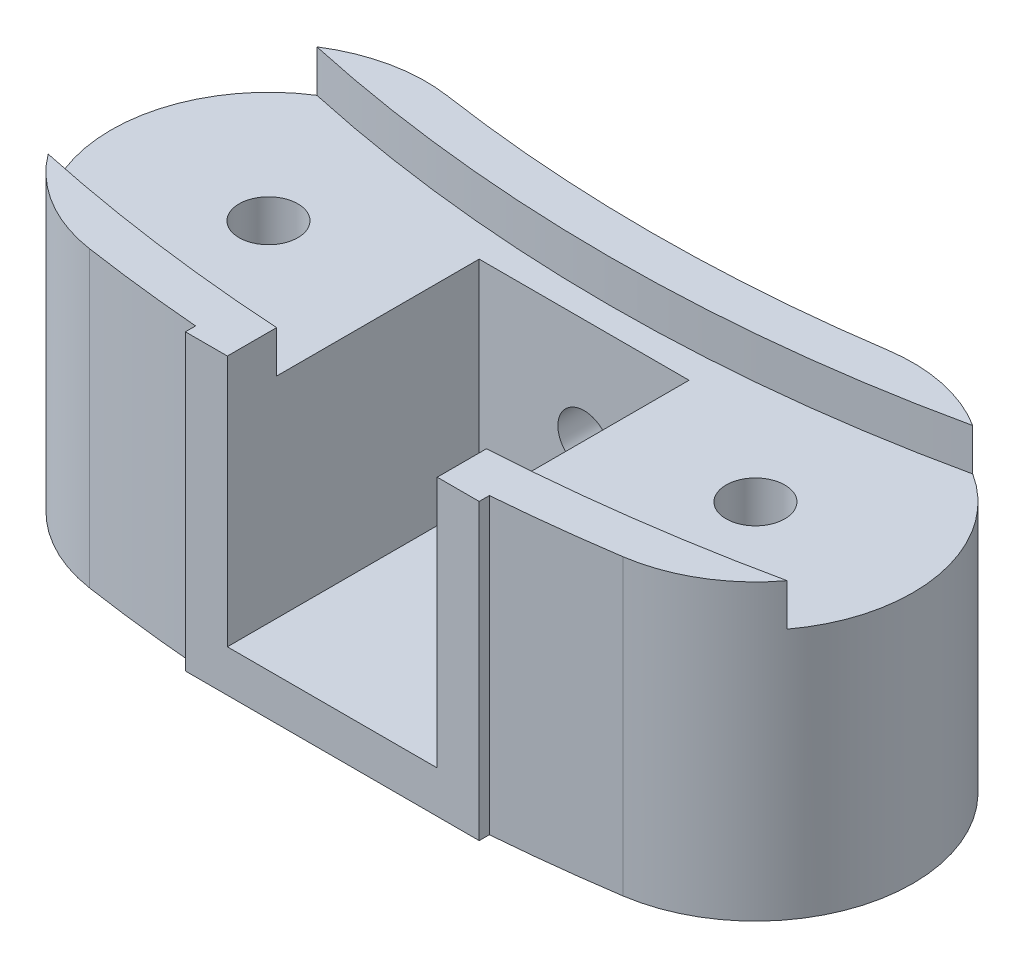
from build123d import *

# Parameters (mm, degrees)
SKETCH2_R                = 1.4
BOSS_EXTRUDE1_DEPTH      = 12
BOSS_EXTRUDE5_DEPTH      = 2
BOSS_EXTRUDE2_REACH      = 30.617
BOSS_EXTRUDE2_END_RADIUS = 86
SKETCH3_W                = 14
SKETCH3_H                = 14
SKETCH15_W               = 10
SKETCH15_H               = 10
SKETCH15_H_2             = 2
CUT_EXTRUDE1_DEPTH       = 12
SKETCH16_R               = 1.25
CUT_EXTRUDE2_DEPTH       = 27.55044426


with BuildPart() as part:
    # Sketch2 → Boss-Extrude1 (new body)
    with BuildSketch(Plane(origin=(0, 0, 0), x_dir=(1, 0, 0), z_dir=(0, 1, 0))):
        with BuildLine():
            ThreePointArc((10.49446819, 8.279873701), (0, 7.5), (-10.49446819, 8.279873701))
            ThreePointArc((-10.49446819, 8.279873701), (-19.020657749, 1.97082531), (-12.711609357, -6.555364249))
            ThreePointArc((-12.711609357, -6.555364249), (0, -7.5), (12.711609357, -6.555364249))
            ThreePointArc((12.711609357, -6.555364249), (19.020657749, 1.97082531), (10.49446819, 8.279873701))
        make_face()
        with Locations(Location((-11.603038774, 0.862254726, 0), (0, 0, 270))):
            Circle(SKETCH2_R, mode=Mode.SUBTRACT)
        with Locations(Location((11.603038774, 0.862254726, 0), (0, 0, 270))):
            Circle(SKETCH2_R, mode=Mode.SUBTRACT)
    extrude(amount=BOSS_EXTRUDE1_DEPTH)

    # Sketch14 → Boss-Extrude5 (add)
    with BuildSketch(Plane(origin=(0, 12, 0), x_dir=(1, 0, 0), z_dir=(0, 1, 0))):
        with BuildLine():
            ThreePointArc((-10.49446819, 8.279873701), (-13.158435282, 8.199198347), (-15.625987479, 7.192016469))
            ThreePointArc((-15.625987479, 7.192016469), (0, 5.5), (15.625987479, 7.192016469))
            ThreePointArc((15.625987479, 7.192016469), (13.158435282, 8.199198347), (10.49446819, 8.279873701))
            ThreePointArc((10.49446819, 8.279873701), (0, 7.5), (-10.49446819, 8.279873701))
        make_face()
        with BuildLine():
            ThreePointArc((17.605627343, -3.634291778), (0, -5.5), (-17.605627343, -3.634291778))
            ThreePointArc((-17.605627343, -3.634291778), (-15.446905606, -5.577829728), (-12.711609357, -6.555364249))
            ThreePointArc((-12.711609357, -6.555364249), (0, -7.5), (12.711609357, -6.555364249))
            ThreePointArc((12.711609357, -6.555364249), (15.446905606, -5.577829728), (17.605627343, -3.634291778))
        make_face()
    extrude(amount=BOSS_EXTRUDE5_DEPTH)

    # Boss-Extrude2: up to this cylinder (the profile starts outside it)
    boss_extrude2_end = Plane(origin=(0, 7, -78.5), z_dir=(0, -1, 0)) * Cylinder(BOSS_EXTRUDE2_END_RADIUS, 234.234, mode=Mode.PRIVATE)
    # Sketch3 → Boss-Extrude2 (add, up to the surface)
    with BuildSketch(Plane.XY.offset(7.7), mode=Mode.PRIVATE) as boss_extrude2_sk1:
        with Locations((0, 7)):
            Rectangle(SKETCH3_W, SKETCH3_H)
    boss_extrude2_tool1 = extrude(boss_extrude2_sk1.sketch, amount=-BOSS_EXTRUDE2_REACH, mode=Mode.PRIVATE) - boss_extrude2_end
    add(boss_extrude2_tool1.solids().sort_by_distance((0, 7, 7.7))[0])

    # Sketch15 → Cut-Extrude1 (cut)
    with BuildSketch(Plane.XY.offset(7.7)):
        with Locations((0, 7)):
            Rectangle(SKETCH15_W, SKETCH15_H)
        with Locations((0, 13)):
            Rectangle(SKETCH15_W, SKETCH15_H_2)
    extrude(amount=-CUT_EXTRUDE1_DEPTH, mode=Mode.SUBTRACT)

    # Sketch16 → Cut-Extrude2 (cut, through all)
    with BuildSketch(Plane.XY.offset(-4.3)):
        with Locations((0, 7)):
            Circle(SKETCH16_R)
    extrude(amount=-CUT_EXTRUDE2_DEPTH, mode=Mode.SUBTRACT)


solid = part.part
